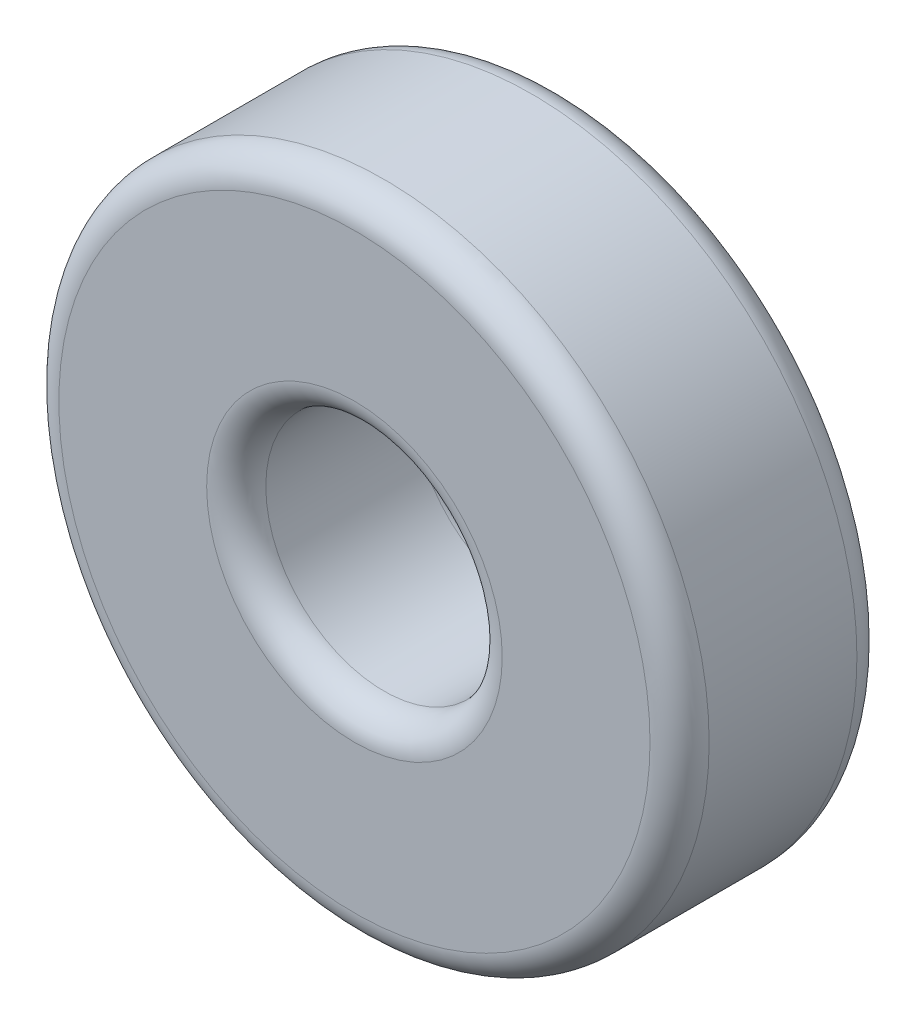
from build123d import *

# Parameters (mm, degrees)
ESQUISSE1_R        = 11
ESQUISSE1_R_2      = 4
BOSS_EXTRU_1_DEPTH = 7
CONG_1_R           = 1


with BuildPart() as part:
    # Esquisse1 → Boss.-Extru.1 (new body)
    with BuildSketch(Plane(origin=(0, 0, 0), x_dir=(0, 1, 0), z_dir=(0, 0, 1))):
        with Locations(Location((0, 0, 0), (0, 0, 270))):
            Circle(ESQUISSE1_R)
        with Locations(Location((0, 0, 0), (0, 0, 270))):
            Circle(ESQUISSE1_R_2, mode=Mode.SUBTRACT)
    extrude(amount=BOSS_EXTRU_1_DEPTH)

    # Congé1
    cong_1_edges = [part.edges().sort_by_distance(p)[0] for p in [
        (-11, 0, 0),
        (-11, 0, 7),
        (-4, 0, 0),
        (-4, 0, 7),
    ]]
    fillet(cong_1_edges, radius=CONG_1_R)


solid = part.part
